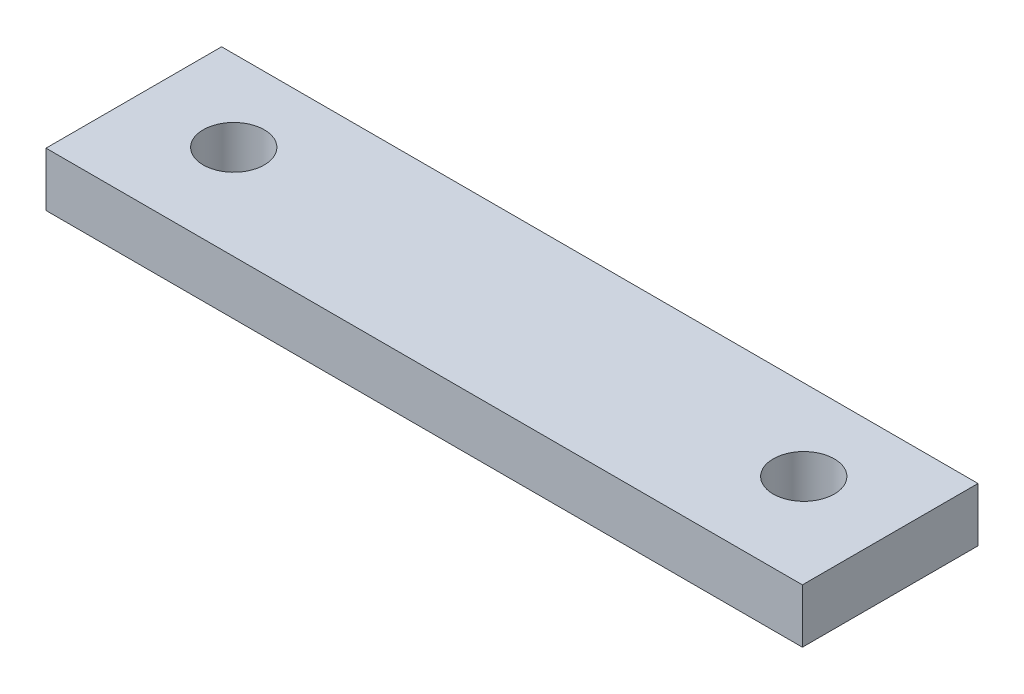
from build123d import *

# Parameters (mm, degrees)
SKETCH1_W           = 35.56
SKETCH1_H           = 8.255
SKETCH1_R           = 1.4351
BOSS_EXTRUDE1_DEPTH = 2.54


with BuildPart() as part:
    # Sketch1 → Boss-Extrude1 (new body)
    with BuildSketch(Plane(origin=(0, 0, 0), x_dir=(1, 0, 0), z_dir=(0, 1, 0))):
        with Locations((0, -0.3175)):
            Rectangle(SKETCH1_W, SKETCH1_H)
        with Locations(Location((-13.3985, 0, 0), (0, 0, 270))):
            Circle(SKETCH1_R, mode=Mode.SUBTRACT)
        with Locations(Location((13.3985, 0, 0), (0, 0, 270))):
            Circle(SKETCH1_R, mode=Mode.SUBTRACT)
    extrude(amount=BOSS_EXTRUDE1_DEPTH)


solid = part.part
